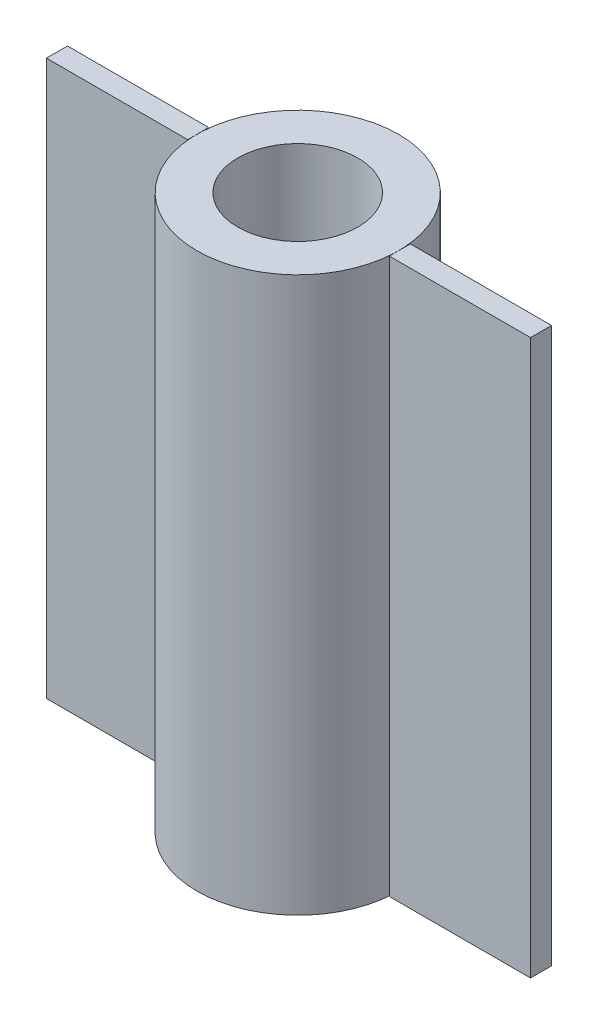
from build123d import *

# Parameters (mm, degrees)
SKETCH2_R           = 12.7
BOSS_EXTRUDE1_DEPTH = 69.85
SKETCH5_R           = 7.557373004
CUT_EXTRUDE1_DEPTH  = 60.96
SKETCH7_W           = 2.647893452
SKETCH7_H           = 69.85
BOSS_EXTRUDE2_DEPTH = 17.78


with BuildPart() as part:
    # Sketch2 → Boss-Extrude1 (new body)
    with BuildSketch(Plane(origin=(0, 0, 0), x_dir=(1, 0, 0), z_dir=(0, 1, 0))):
        with Locations(Location((0, 0, 0), (0, 0, 270))):
            Circle(SKETCH2_R)
    extrude(amount=BOSS_EXTRUDE1_DEPTH)

    # Sketch5 → Cut-Extrude1 (cut)
    with BuildSketch(Plane(origin=(0, 69.85, 0), x_dir=(1, 0, 0), z_dir=(0, 1, 0))):
        with Locations(Location((0, 0, 0), (0, 0, 270))):
            Circle(SKETCH5_R)
    extrude(amount=-CUT_EXTRUDE1_DEPTH, mode=Mode.SUBTRACT)


with BuildPart() as body_2:
    # Sketch7 → Boss-Extrude2 (new body)
    with BuildSketch(Plane(origin=(12.7, 0, 0), x_dir=(0, 0, -1), z_dir=(1, 0, 0))):
        with Locations((0.158873607, 34.925)):
            Rectangle(SKETCH7_W, SKETCH7_H)
    extrude(amount=BOSS_EXTRUDE2_DEPTH)


with BuildPart() as body_3:
    # Mirror3: mirrored copy
    add(body_2.part.mirror(Plane(origin=(0, 0, 0), x_dir=(0, 0, 1), z_dir=(1, 0, 0))))


solid = Compound([part.part, body_2.part, body_3.part])
